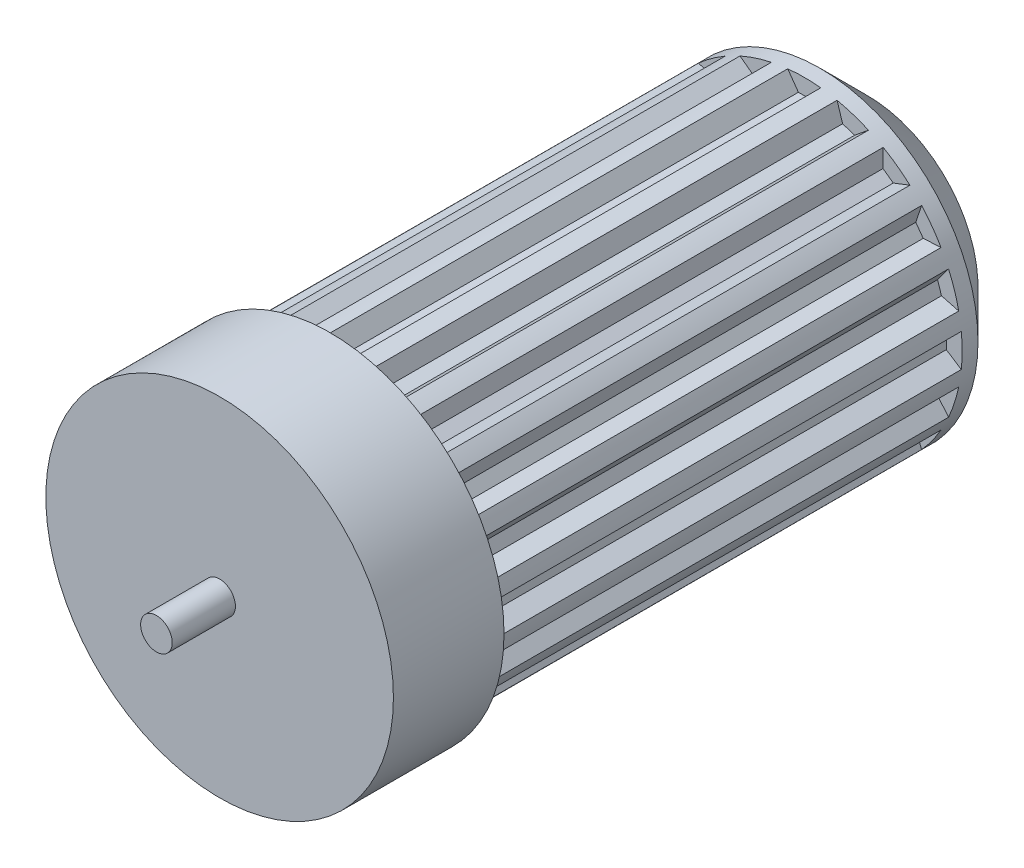
from build123d import *

# Parameters (mm, degrees)
SKETCH1_R           = 100
BOSS_EXTRUDE1_DEPTH = 300
CUT_EXTRUDE1_REACH  = 333.662
BOSS_EXTRUDE3_START = 40
SKETCH4_R           = 100
BOSS_EXTRUDE3_DEPTH = 40
CHAMFER1_SIZE       = 30
SKETCH5_R           = 110
BOSS_EXTRUDE4_DEPTH = 70
SKETCH6_R           = 10
BOSS_EXTRUDE5_DEPTH = 40


with BuildPart() as part:
    # Sketch1 → Boss-Extrude1 (new body)
    with BuildSketch(Plane.XY):
        Circle(SKETCH1_R)
    extrude(amount=BOSS_EXTRUDE1_DEPTH)

    # Sketch3 → Cut-Extrude1 (cut, up to next)
    with BuildSketch(Plane(origin=(0, 0, 0), x_dir=(-1, 0, 0), z_dir=(0, 0, -1)), mode=Mode.PRIVATE) as cut_extrude1_sk1:
        with BuildLine():
            Line((-10.46691071, 99.450710305), (-4.346948216, 89.941443019))
            Line((-4.346948216, 89.941443019), (3.66602129, 89.941443019))
            Line((3.66602129, 89.941443019), (10.434028252, 99.454165596))
            ThreePointArc((10.434028252, 99.454165596), (-0.01653175, 99.999998634), (-10.46691071, 99.450710305))
        make_face()
    cut_extrude1_tool1 = extrude(cut_extrude1_sk1.sketch, amount=-CUT_EXTRUDE1_REACH, mode=Mode.PRIVATE) & part.part
    # Sketch3 → Cut-Extrude1 (cut, up to next)
    with BuildSketch(Plane(origin=(0, 0, 0), x_dir=(-1, 0, 0), z_dir=(0, 0, -1)), mode=Mode.PRIVATE) as cut_extrude1_sk2:
        with BuildLine():
            Line((20.777335951, 97.817699374), (23.659240965, 86.88267634))
            Line((23.659240965, 86.88267634), (31.280027828, 84.406532588))
            Line((31.280027828, 84.406532588), (40.656377891, 91.362240213))
            ThreePointArc((40.656377891, 91.362240213), (30.885976386, 95.110758922), (20.777335951, 97.817699374))
        make_face()
    cut_extrude1_tool2 = extrude(cut_extrude1_sk2.sketch, amount=-CUT_EXTRUDE1_REACH, mode=Mode.PRIVATE) & part.part
    # Sketch3 → Cut-Extrude1 (cut, up to next)
    with BuildSketch(Plane(origin=(0, 0, 0), x_dir=(-1, 0, 0), z_dir=(0, 0, -1)), mode=Mode.PRIVATE) as cut_extrude1_sk3:
        with BuildLine():
            Line((49.987752204, 86.609610492), (49.349498796, 75.319227955))
            Line((49.349498796, 75.319227955), (55.832127301, 70.609322652))
            Line((55.832127301, 70.609322652), (66.898997992, 74.3271422))
            ThreePointArc((66.898997992, 74.3271422), (58.765149959, 80.911415451), (49.987752204, 86.609610492))
        make_face()
    cut_extrude1_tool3 = extrude(cut_extrude1_sk3.sketch, amount=-CUT_EXTRUDE1_REACH, mode=Mode.PRIVATE) & part.part
    # Sketch3 → Cut-Extrude1 (cut, up to next)
    with BuildSketch(Plane(origin=(0, 0, 0), x_dir=(-1, 0, 0), z_dir=(0, 0, -1)), mode=Mode.PRIVATE) as cut_extrude1_sk4:
        with BuildLine():
            Line((74.305018987, 66.92356949), (70.209083847, 56.383008757))
            Line((70.209083847, 56.383008757), (74.918989149, 49.900380251))
            Line((74.918989149, 49.900380251), (86.593078057, 50.016385641))
            ThreePointArc((86.593078057, 50.016385641), (80.891981213, 58.791898893), (74.305018987, 66.92356949))
        make_face()
    cut_extrude1_tool4 = extrude(cut_extrude1_sk4.sketch, amount=-CUT_EXTRUDE1_REACH, mode=Mode.PRIVATE) & part.part
    # Sketch3 → Cut-Extrude1 (cut, up to next)
    with BuildSketch(Plane(origin=(0, 0, 0), x_dir=(-1, 0, 0), z_dir=(0, 0, -1)), mode=Mode.PRIVATE) as cut_extrude1_sk5:
        with BuildLine():
            Line((91.348792798, 40.686583223), (84.196114596, 31.927627818))
            Line((84.196114596, 31.927627818), (86.672258348, 24.306840955))
            Line((86.672258348, 24.306840955), (97.810824313, 20.80967677))
            ThreePointArc((97.810824313, 20.80967677), (95.100541738, 30.917421644), (91.348792798, 40.686583223))
        make_face()
    cut_extrude1_tool5 = extrude(cut_extrude1_sk5.sketch, amount=-CUT_EXTRUDE1_REACH, mode=Mode.PRIVATE) & part.part
    # Sketch3 → Cut-Extrude1 (cut, up to next)
    with BuildSketch(Plane(origin=(0, 0, 0), x_dir=(-1, 0, 0), z_dir=(0, 0, -1)), mode=Mode.PRIVATE) as cut_extrude1_sk6:
        with BuildLine():
            Line((99.450710305, 10.46691071), (89.941443019, 4.346948216))
            Line((89.941443019, 4.346948216), (89.941443019, -3.66602129))
            Line((89.941443019, -3.66602129), (99.454165596, -10.434028252))
            ThreePointArc((99.454165596, -10.434028252), (99.999998634, 0.01653175), (99.450710305, 10.46691071))
        make_face()
    cut_extrude1_tool6 = extrude(cut_extrude1_sk6.sketch, amount=-CUT_EXTRUDE1_REACH, mode=Mode.PRIVATE) & part.part
    # Sketch3 → Cut-Extrude1 (cut, up to next)
    with BuildSketch(Plane(origin=(0, 0, 0), x_dir=(-1, 0, 0), z_dir=(0, 0, -1)), mode=Mode.PRIVATE) as cut_extrude1_sk7:
        with BuildLine():
            Line((97.817699374, -20.777335951), (86.88267634, -23.659240965))
            Line((86.88267634, -23.659240965), (84.406532588, -31.280027828))
            Line((84.406532588, -31.280027828), (91.362240213, -40.656377891))
            ThreePointArc((91.362240213, -40.656377891), (95.110758922, -30.885976386), (97.817699374, -20.777335951))
        make_face()
    cut_extrude1_tool7 = extrude(cut_extrude1_sk7.sketch, amount=-CUT_EXTRUDE1_REACH, mode=Mode.PRIVATE) & part.part
    # Sketch3 → Cut-Extrude1 (cut, up to next)
    with BuildSketch(Plane(origin=(0, 0, 0), x_dir=(-1, 0, 0), z_dir=(0, 0, -1)), mode=Mode.PRIVATE) as cut_extrude1_sk8:
        with BuildLine():
            Line((86.609610492, -49.987752204), (75.319227955, -49.349498796))
            Line((75.319227955, -49.349498796), (70.609322652, -55.832127301))
            Line((70.609322652, -55.832127301), (74.3271422, -66.898997992))
            ThreePointArc((74.3271422, -66.898997992), (80.911415451, -58.765149959), (86.609610492, -49.987752204))
        make_face()
    cut_extrude1_tool8 = extrude(cut_extrude1_sk8.sketch, amount=-CUT_EXTRUDE1_REACH, mode=Mode.PRIVATE) & part.part
    # Sketch3 → Cut-Extrude1 (cut, up to next)
    with BuildSketch(Plane(origin=(0, 0, 0), x_dir=(-1, 0, 0), z_dir=(0, 0, -1)), mode=Mode.PRIVATE) as cut_extrude1_sk9:
        with BuildLine():
            Line((66.92356949, -74.305018987), (56.383008757, -70.209083847))
            Line((56.383008757, -70.209083847), (49.900380251, -74.918989149))
            Line((49.900380251, -74.918989149), (50.016385641, -86.593078057))
            ThreePointArc((50.016385641, -86.593078057), (58.791898893, -80.891981213), (66.92356949, -74.305018987))
        make_face()
    cut_extrude1_tool9 = extrude(cut_extrude1_sk9.sketch, amount=-CUT_EXTRUDE1_REACH, mode=Mode.PRIVATE) & part.part
    # Sketch3 → Cut-Extrude1 (cut, up to next)
    with BuildSketch(Plane(origin=(0, 0, 0), x_dir=(-1, 0, 0), z_dir=(0, 0, -1)), mode=Mode.PRIVATE) as cut_extrude1_sk10:
        with BuildLine():
            Line((40.686583223, -91.348792798), (31.927627818, -84.196114596))
            Line((31.927627818, -84.196114596), (24.306840955, -86.672258348))
            Line((24.306840955, -86.672258348), (20.80967677, -97.810824313))
            ThreePointArc((20.80967677, -97.810824313), (30.917421644, -95.100541738), (40.686583223, -91.348792798))
        make_face()
    cut_extrude1_tool10 = extrude(cut_extrude1_sk10.sketch, amount=-CUT_EXTRUDE1_REACH, mode=Mode.PRIVATE) & part.part
    # Sketch3 → Cut-Extrude1 (cut, up to next)
    with BuildSketch(Plane(origin=(0, 0, 0), x_dir=(-1, 0, 0), z_dir=(0, 0, -1)), mode=Mode.PRIVATE) as cut_extrude1_sk11:
        with BuildLine():
            Line((10.46691071, -99.450710305), (4.346948216, -89.941443019))
            Line((4.346948216, -89.941443019), (-3.66602129, -89.941443019))
            Line((-3.66602129, -89.941443019), (-10.434028252, -99.454165596))
            ThreePointArc((-10.434028252, -99.454165596), (0.01653175, -99.999998634), (10.46691071, -99.450710305))
        make_face()
    cut_extrude1_tool11 = extrude(cut_extrude1_sk11.sketch, amount=-CUT_EXTRUDE1_REACH, mode=Mode.PRIVATE) & part.part
    # Sketch3 → Cut-Extrude1 (cut, up to next)
    with BuildSketch(Plane(origin=(0, 0, 0), x_dir=(-1, 0, 0), z_dir=(0, 0, -1)), mode=Mode.PRIVATE) as cut_extrude1_sk12:
        with BuildLine():
            Line((-20.777335951, -97.817699374), (-23.659240965, -86.88267634))
            Line((-23.659240965, -86.88267634), (-31.280027828, -84.406532588))
            Line((-31.280027828, -84.406532588), (-40.656377891, -91.362240213))
            ThreePointArc((-40.656377891, -91.362240213), (-30.885976386, -95.110758922), (-20.777335951, -97.817699374))
        make_face()
    cut_extrude1_tool12 = extrude(cut_extrude1_sk12.sketch, amount=-CUT_EXTRUDE1_REACH, mode=Mode.PRIVATE) & part.part
    # Sketch3 → Cut-Extrude1 (cut, up to next)
    with BuildSketch(Plane(origin=(0, 0, 0), x_dir=(-1, 0, 0), z_dir=(0, 0, -1)), mode=Mode.PRIVATE) as cut_extrude1_sk13:
        with BuildLine():
            Line((-49.987752204, -86.609610492), (-49.349498796, -75.319227955))
            Line((-49.349498796, -75.319227955), (-55.832127301, -70.609322652))
            Line((-55.832127301, -70.609322652), (-66.898997992, -74.3271422))
            ThreePointArc((-66.898997992, -74.3271422), (-58.765149959, -80.911415451), (-49.987752204, -86.609610492))
        make_face()
    cut_extrude1_tool13 = extrude(cut_extrude1_sk13.sketch, amount=-CUT_EXTRUDE1_REACH, mode=Mode.PRIVATE) & part.part
    # Sketch3 → Cut-Extrude1 (cut, up to next)
    with BuildSketch(Plane(origin=(0, 0, 0), x_dir=(-1, 0, 0), z_dir=(0, 0, -1)), mode=Mode.PRIVATE) as cut_extrude1_sk14:
        with BuildLine():
            Line((-74.305018987, -66.92356949), (-70.209083847, -56.383008757))
            Line((-70.209083847, -56.383008757), (-74.918989149, -49.900380251))
            Line((-74.918989149, -49.900380251), (-86.593078057, -50.016385641))
            ThreePointArc((-86.593078057, -50.016385641), (-80.891981213, -58.791898893), (-74.305018987, -66.92356949))
        make_face()
    cut_extrude1_tool14 = extrude(cut_extrude1_sk14.sketch, amount=-CUT_EXTRUDE1_REACH, mode=Mode.PRIVATE) & part.part
    # Sketch3 → Cut-Extrude1 (cut, up to next)
    with BuildSketch(Plane(origin=(0, 0, 0), x_dir=(-1, 0, 0), z_dir=(0, 0, -1)), mode=Mode.PRIVATE) as cut_extrude1_sk15:
        with BuildLine():
            Line((-91.348792798, -40.686583223), (-84.196114596, -31.927627818))
            Line((-84.196114596, -31.927627818), (-86.672258348, -24.306840955))
            Line((-86.672258348, -24.306840955), (-97.810824313, -20.80967677))
            ThreePointArc((-97.810824313, -20.80967677), (-95.100541738, -30.917421644), (-91.348792798, -40.686583223))
        make_face()
    cut_extrude1_tool15 = extrude(cut_extrude1_sk15.sketch, amount=-CUT_EXTRUDE1_REACH, mode=Mode.PRIVATE) & part.part
    # Sketch3 → Cut-Extrude1 (cut, up to next)
    with BuildSketch(Plane(origin=(0, 0, 0), x_dir=(-1, 0, 0), z_dir=(0, 0, -1)), mode=Mode.PRIVATE) as cut_extrude1_sk16:
        with BuildLine():
            Line((-99.450710305, -10.46691071), (-89.941443019, -4.346948216))
            Line((-89.941443019, -4.346948216), (-89.941443019, 3.66602129))
            Line((-89.941443019, 3.66602129), (-99.454165596, 10.434028252))
            ThreePointArc((-99.454165596, 10.434028252), (-99.999998634, -0.01653175), (-99.450710305, -10.46691071))
        make_face()
    cut_extrude1_tool16 = extrude(cut_extrude1_sk16.sketch, amount=-CUT_EXTRUDE1_REACH, mode=Mode.PRIVATE) & part.part
    # Sketch3 → Cut-Extrude1 (cut, up to next)
    with BuildSketch(Plane(origin=(0, 0, 0), x_dir=(-1, 0, 0), z_dir=(0, 0, -1)), mode=Mode.PRIVATE) as cut_extrude1_sk17:
        with BuildLine():
            Line((-97.817699374, 20.777335951), (-86.88267634, 23.659240965))
            Line((-86.88267634, 23.659240965), (-84.406532588, 31.280027828))
            Line((-84.406532588, 31.280027828), (-91.362240213, 40.656377891))
            ThreePointArc((-91.362240213, 40.656377891), (-95.110758922, 30.885976386), (-97.817699374, 20.777335951))
        make_face()
    cut_extrude1_tool17 = extrude(cut_extrude1_sk17.sketch, amount=-CUT_EXTRUDE1_REACH, mode=Mode.PRIVATE) & part.part
    # Sketch3 → Cut-Extrude1 (cut, up to next)
    with BuildSketch(Plane(origin=(0, 0, 0), x_dir=(-1, 0, 0), z_dir=(0, 0, -1)), mode=Mode.PRIVATE) as cut_extrude1_sk18:
        with BuildLine():
            Line((-86.609610492, 49.987752204), (-75.319227955, 49.349498796))
            Line((-75.319227955, 49.349498796), (-70.609322652, 55.832127301))
            Line((-70.609322652, 55.832127301), (-74.3271422, 66.898997992))
            ThreePointArc((-74.3271422, 66.898997992), (-80.911415451, 58.765149959), (-86.609610492, 49.987752204))
        make_face()
    cut_extrude1_tool18 = extrude(cut_extrude1_sk18.sketch, amount=-CUT_EXTRUDE1_REACH, mode=Mode.PRIVATE) & part.part
    # Sketch3 → Cut-Extrude1 (cut, up to next)
    with BuildSketch(Plane(origin=(0, 0, 0), x_dir=(-1, 0, 0), z_dir=(0, 0, -1)), mode=Mode.PRIVATE) as cut_extrude1_sk19:
        with BuildLine():
            Line((-66.92356949, 74.305018987), (-56.383008757, 70.209083847))
            Line((-56.383008757, 70.209083847), (-49.900380251, 74.918989149))
            Line((-49.900380251, 74.918989149), (-50.016385641, 86.593078057))
            ThreePointArc((-50.016385641, 86.593078057), (-58.791898893, 80.891981213), (-66.92356949, 74.305018987))
        make_face()
    cut_extrude1_tool19 = extrude(cut_extrude1_sk19.sketch, amount=-CUT_EXTRUDE1_REACH, mode=Mode.PRIVATE) & part.part
    # Sketch3 → Cut-Extrude1 (cut, up to next)
    with BuildSketch(Plane(origin=(0, 0, 0), x_dir=(-1, 0, 0), z_dir=(0, 0, -1)), mode=Mode.PRIVATE) as cut_extrude1_sk20:
        with BuildLine():
            Line((-40.686583223, 91.348792798), (-31.927627818, 84.196114596))
            Line((-31.927627818, 84.196114596), (-24.306840955, 86.672258348))
            Line((-24.306840955, 86.672258348), (-20.80967677, 97.810824313))
            ThreePointArc((-20.80967677, 97.810824313), (-30.917421644, 95.100541738), (-40.686583223, 91.348792798))
        make_face()
    cut_extrude1_tool20 = extrude(cut_extrude1_sk20.sketch, amount=-CUT_EXTRUDE1_REACH, mode=Mode.PRIVATE) & part.part
    add(cut_extrude1_tool1.solids().sort_by_distance((0.146898, 95.627996, 0))[0], mode=Mode.SUBTRACT)
    add(cut_extrude1_tool2.solids().sort_by_distance((-29.410968, 90.993022, 0))[0], mode=Mode.SUBTRACT)
    add(cut_extrude1_tool3.solids().sort_by_distance((-56.089883, 77.451018, 0))[0], mode=Mode.SUBTRACT)
    add(cut_extrude1_tool4.solids().sort_by_distance((-77.278329, 56.327568, 0))[0], mode=Mode.SUBTRACT)
    add(cut_extrude1_tool5.solids().sort_by_distance((-90.902235, 29.690384, 0))[0], mode=Mode.SUBTRACT)
    add(cut_extrude1_tool6.solids().sort_by_distance((-95.627996, 0.146898, 0))[0], mode=Mode.SUBTRACT)
    add(cut_extrude1_tool7.solids().sort_by_distance((-90.993022, -29.410968, 0))[0], mode=Mode.SUBTRACT)
    add(cut_extrude1_tool8.solids().sort_by_distance((-77.451018, -56.089883, 0))[0], mode=Mode.SUBTRACT)
    add(cut_extrude1_tool9.solids().sort_by_distance((-56.327568, -77.278329, 0))[0], mode=Mode.SUBTRACT)
    add(cut_extrude1_tool10.solids().sort_by_distance((-29.690384, -90.902235, 0))[0], mode=Mode.SUBTRACT)
    add(cut_extrude1_tool11.solids().sort_by_distance((-0.146898, -95.627996, 0))[0], mode=Mode.SUBTRACT)
    add(cut_extrude1_tool12.solids().sort_by_distance((29.410968, -90.993022, 0))[0], mode=Mode.SUBTRACT)
    add(cut_extrude1_tool13.solids().sort_by_distance((56.089883, -77.451018, 0))[0], mode=Mode.SUBTRACT)
    add(cut_extrude1_tool14.solids().sort_by_distance((77.278329, -56.327568, 0))[0], mode=Mode.SUBTRACT)
    add(cut_extrude1_tool15.solids().sort_by_distance((90.902235, -29.690384, 0))[0], mode=Mode.SUBTRACT)
    add(cut_extrude1_tool16.solids().sort_by_distance((95.627996, -0.146898, 0))[0], mode=Mode.SUBTRACT)
    add(cut_extrude1_tool17.solids().sort_by_distance((90.993022, 29.410968, 0))[0], mode=Mode.SUBTRACT)
    add(cut_extrude1_tool18.solids().sort_by_distance((77.451018, 56.089883, 0))[0], mode=Mode.SUBTRACT)
    add(cut_extrude1_tool19.solids().sort_by_distance((56.327568, 77.278329, 0))[0], mode=Mode.SUBTRACT)
    add(cut_extrude1_tool20.solids().sort_by_distance((29.690384, 90.902235, 0))[0], mode=Mode.SUBTRACT)

    # Sketch4 → Boss-Extrude3 (add)
    with BuildSketch(Plane(origin=(0, 0, 0), x_dir=(-1, 0, 0), z_dir=(0, 0, -1)).offset(BOSS_EXTRUDE3_START)):
        Circle(SKETCH4_R)
    extrude(amount=-BOSS_EXTRUDE3_DEPTH)

    # Chamfer1
    chamfer1_edges = [part.edges().sort_by_distance(p)[0] for p in [
        (100, 0, -40),
    ]]
    chamfer(chamfer1_edges, length=CHAMFER1_SIZE)

    # Sketch5 → Boss-Extrude4 (add)
    with BuildSketch(Plane.XY.offset(300)):
        Circle(SKETCH5_R)
    extrude(amount=BOSS_EXTRUDE4_DEPTH)

    # Sketch6 → Boss-Extrude5 (add)
    with BuildSketch(Plane.XY.offset(370)):
        Circle(SKETCH6_R)
    extrude(amount=BOSS_EXTRUDE5_DEPTH)


solid = part.part
